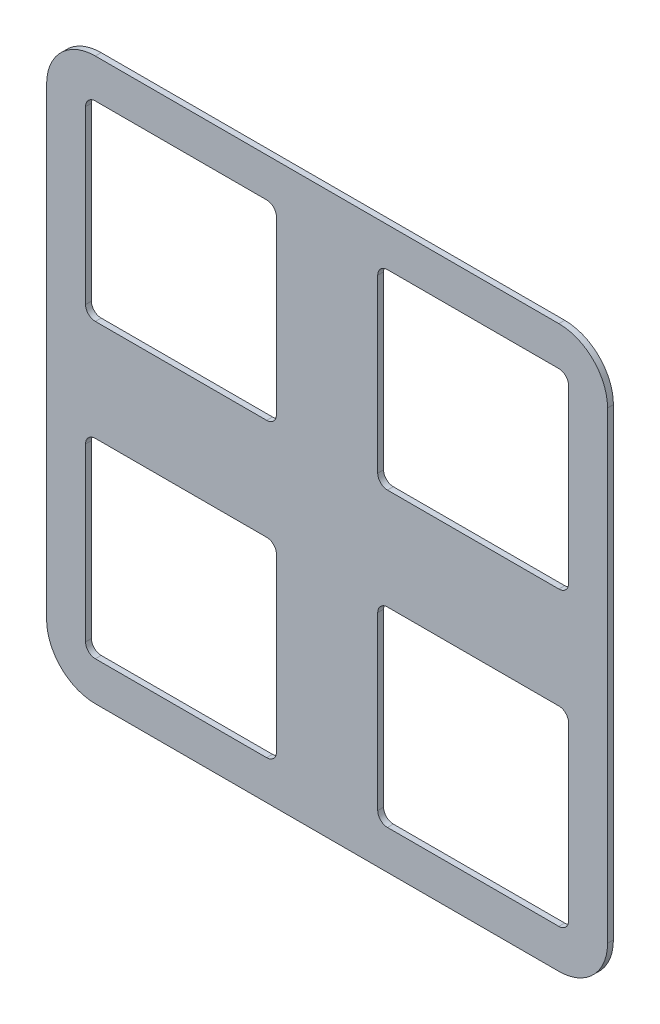
from build123d import *

# Parameters (mm, degrees)
BOSS_EXTRUDE1_DEPTH = 3


with BuildPart() as part:
    # Sketch1 → Boss-Extrude1 (new body)
    with BuildSketch(Plane.XY):
        with BuildLine():
            Line((25, 0), (263, 0))
            ThreePointArc((263, 0), (280.67766953, 7.32233047), (288, 25))
            Line((288, 25), (288, 263))
            ThreePointArc((288, 263), (280.67766953, 280.67766953), (263, 288))
            Line((263, 288), (25, 288))
            ThreePointArc((25, 288), (7.32233047, 280.67766953), (0, 263))
            Line((0, 263), (0, 25))
            ThreePointArc((0, 25), (7.32233047, 7.32233047), (25, 0))
        make_face()
        with BuildLine():
            Line((25, 170), (113, 170))
            ThreePointArc((113, 170), (116.535533906, 171.464466094), (118, 175))
            Line((118, 175), (118, 263))
            ThreePointArc((118, 263), (116.535533906, 266.535533906), (113, 268))
            Line((113, 268), (25, 268))
            ThreePointArc((25, 268), (21.464466094, 266.535533906), (20, 263))
            Line((20, 263), (20, 175))
            ThreePointArc((20, 175), (21.464466094, 171.464466094), (25, 170))
        make_face(mode=Mode.SUBTRACT)
        with BuildLine():
            Line((118, 113), (118, 25))
            ThreePointArc((118, 25), (116.535533906, 21.464466094), (113, 20))
            Line((113, 20), (25, 20))
            ThreePointArc((25, 20), (21.464466094, 21.464466094), (20, 25))
            Line((20, 25), (20, 113))
            ThreePointArc((20, 113), (21.464466094, 116.535533906), (25, 118))
            Line((25, 118), (113, 118))
            ThreePointArc((113, 118), (116.535533906, 116.535533906), (118, 113))
        make_face(mode=Mode.SUBTRACT)
        with BuildLine():
            Line((263, 118), (175, 118))
            ThreePointArc((175, 118), (171.464466094, 116.535533906), (170, 113))
            Line((170, 113), (170, 25))
            ThreePointArc((170, 25), (171.464466094, 21.464466094), (175, 20))
            Line((175, 20), (263, 20))
            ThreePointArc((263, 20), (266.535533906, 21.464466094), (268, 25))
            Line((268, 25), (268, 113))
            ThreePointArc((268, 113), (266.535533906, 116.535533906), (263, 118))
        make_face(mode=Mode.SUBTRACT)
        with BuildLine():
            Line((170, 175), (170, 263))
            ThreePointArc((170, 263), (171.464466094, 266.535533906), (175, 268))
            Line((175, 268), (263, 268))
            ThreePointArc((263, 268), (266.535533906, 266.535533906), (268, 263))
            Line((268, 263), (268, 175))
            ThreePointArc((268, 175), (266.535533906, 171.464466094), (263, 170))
            Line((263, 170), (175, 170))
            ThreePointArc((175, 170), (171.464466094, 171.464466094), (170, 175))
        make_face(mode=Mode.SUBTRACT)
    extrude(amount=BOSS_EXTRUDE1_DEPTH)


solid = part.part
